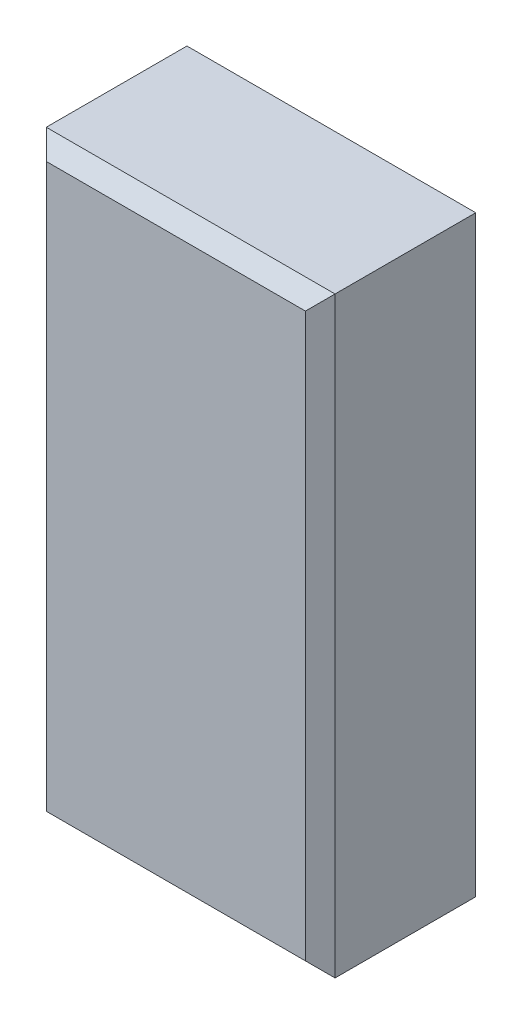
from build123d import *

# Parameters (mm, degrees)
SKETCH1_W           = 19.5
SKETCH1_H           = 40
BOSS_EXTRUDE1_DEPTH = 11.5
CHAMFER1_SIZE       = 1


with BuildPart() as part:
    # Sketch1 → Boss-Extrude1 (new body)
    with BuildSketch(Plane.XY):
        Rectangle(SKETCH1_W, SKETCH1_H)
    extrude(amount=BOSS_EXTRUDE1_DEPTH)

    # Chamfer1
    chamfer1_edges = [part.edges().sort_by_distance(p)[0] for p in [
        (-9.75, 0, 11.5),
        (0, -20, 11.5),
        (9.75, 0, 11.5),
        (0, -20, 0),
        (-9.75, 0, 0),
        (0, 20, 0),
        (9.75, 0, 0),
        (0, 20, 11.5),
    ]]
    chamfer(chamfer1_edges, length=CHAMFER1_SIZE)


solid = part.part
